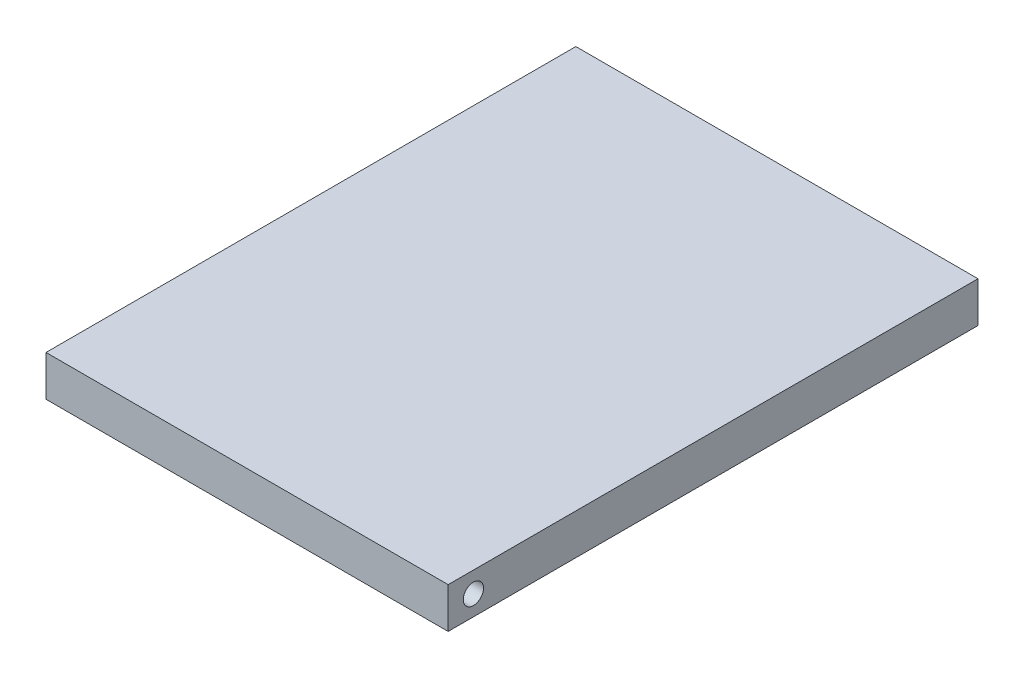
from build123d import *

# Parameters (mm, degrees)
SKETCH1_W           = 29.74762565
SKETCH1_H           = 39.191316334
BOSS_EXTRUDE1_DEPTH = 3
SKETCH2_R           = 0.75
CUT_EXTRUDE1_DEPTH  = 13


with BuildPart() as part:
    # Sketch1 → Boss-Extrude1 (new body)
    with BuildSketch(Plane(origin=(0, 0, 0), x_dir=(1, 0, 0), z_dir=(0, 1, 0))):
        Rectangle(SKETCH1_W, SKETCH1_H)
    extrude(amount=BOSS_EXTRUDE1_DEPTH)

    # Sketch2 → Cut-Extrude1 (cut)
    with BuildSketch(Plane(origin=(14.873812825, 0, 0), x_dir=(0, 0, -1), z_dir=(1, 0, 0))):
        with Locations((-17.727763699, 1.476799279)):
            Circle(SKETCH2_R)
    extrude(amount=-CUT_EXTRUDE1_DEPTH, mode=Mode.SUBTRACT)


solid = part.part
